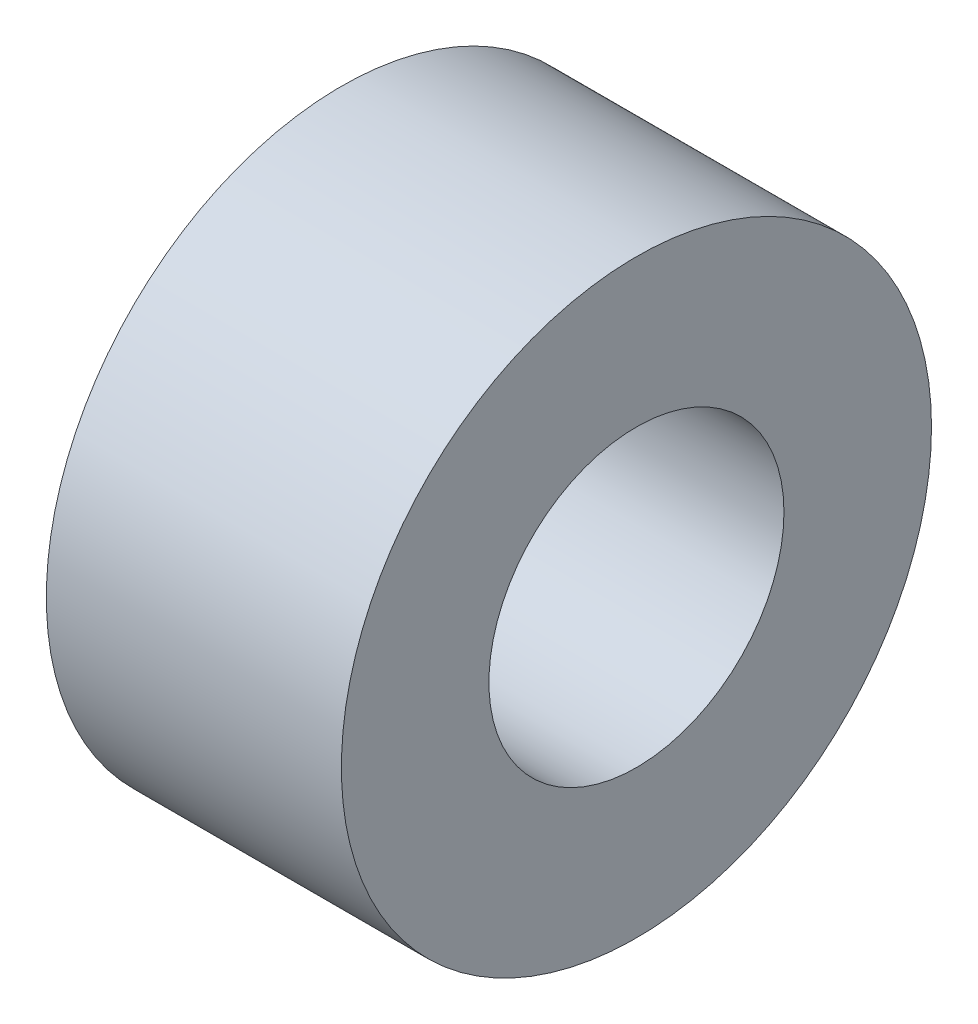
from build123d import *

# Parameters (mm, degrees)
BOSS_EXTRU_1_DEPTH      = 2.5
BOSS_EXTRU_1_DEPTH_BACK = 2.5
ESQUISSE1_R             = 5
ESQUISSE2_R             = 2.5
ENL_V_MAT_EXTRU_1_DEPTH = 9.660254038


with BuildPart() as part:
    # Esquisse1 → Boss.-Extru.1 (new, two sides: drawn at the far end of the back side and taken through both)
    with BuildSketch(Plane(origin=(0, 0, 0), x_dir=(0, 0, -1), z_dir=(1, 0, 0)).offset(-BOSS_EXTRU_1_DEPTH_BACK)):
        Circle(ESQUISSE1_R)
    extrude(amount=BOSS_EXTRU_1_DEPTH + BOSS_EXTRU_1_DEPTH_BACK)

    # Esquisse2 → Enlèv. mat.-Extru.1 (cut, through all)
    with BuildSketch(Plane(origin=(2.5, 0, 0), x_dir=(0, 0, -1), z_dir=(1, 0, 0))):
        Circle(ESQUISSE2_R)
    extrude(amount=-ENL_V_MAT_EXTRU_1_DEPTH, mode=Mode.SUBTRACT)


solid = part.part
